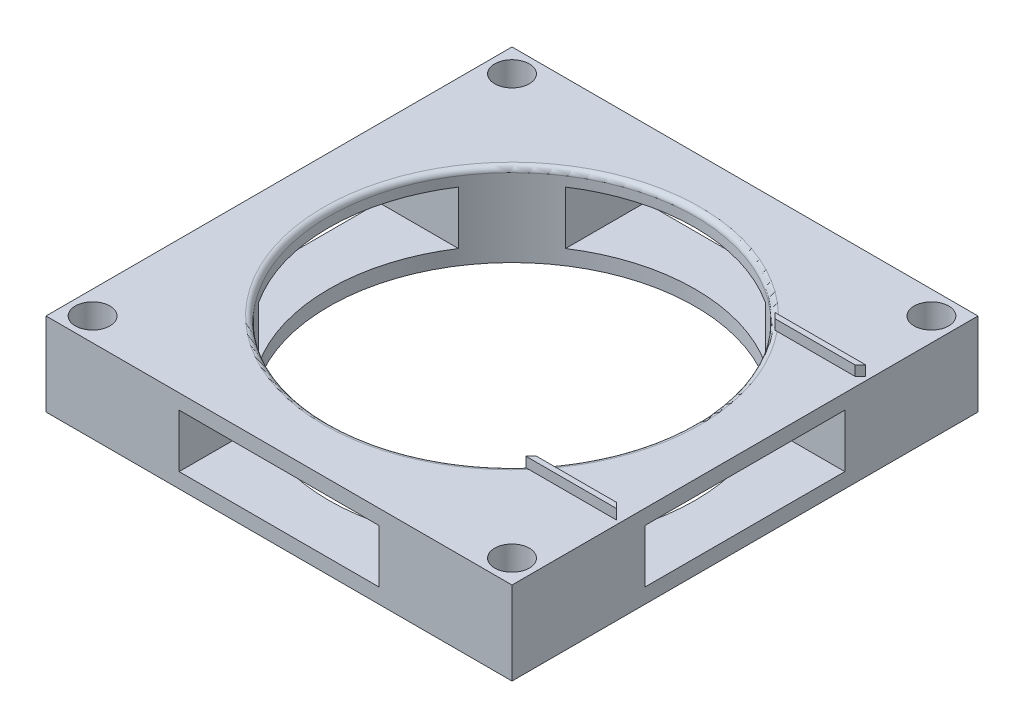
from build123d import *

# Parameters (mm, degrees)
SKETCH1_W           = 70
SKETCH1_H           = 70
SKETCH1_R           = 2.6
BOSS_EXTRUDE1_DEPTH = 12.5
SKETCH2_R           = 27.5
CUT_EXTRUDE1_DEPTH  = 14
FILLET1_R           = 0.8
BOSS_EXTRUDE2_DEPTH = 1.5
SKETCH5_W           = 30
SKETCH5_H           = 8
CUT_EXTRUDE2_DEPTH  = 80.504716841
SKETCH6_W           = 30
SKETCH6_H           = 8
CUT_EXTRUDE3_DEPTH  = 80.504716841


with BuildPart() as part:
    # Sketch1 → Boss-Extrude1 (new body)
    with BuildSketch(Plane(origin=(0, 0, 0), x_dir=(1, 0, 0), z_dir=(0, 1, 0))):
        Rectangle(SKETCH1_W, SKETCH1_H)
        with Locations(Location((31.5, 31.5, 0), (0, 0, 270))):
            Circle(SKETCH1_R, mode=Mode.SUBTRACT)
        with Locations(Location((-31.5, 31.5, 0), (0, 0, 270))):
            Circle(SKETCH1_R, mode=Mode.SUBTRACT)
        with Locations(Location((31.5, -31.5, 0), (0, 0, 270))):
            Circle(SKETCH1_R, mode=Mode.SUBTRACT)
        with Locations(Location((-31.5, -31.5, 0), (0, 0, 270))):
            Circle(SKETCH1_R, mode=Mode.SUBTRACT)
    extrude(amount=BOSS_EXTRUDE1_DEPTH)

    # Sketch2 → Cut-Extrude1 (cut)
    with BuildSketch(Plane(origin=(0, 12.5, 0), x_dir=(1, 0, 0), z_dir=(0, 1, 0))):
        with Locations(Location((0, 0, 0), (0, 0, 270))):
            Circle(SKETCH2_R)
    extrude(amount=-CUT_EXTRUDE1_DEPTH, mode=Mode.SUBTRACT)

    # Fillet1
    fillet1_edges = [part.edges().sort_by_distance(p)[0] for p in [
        (0, 12.5, -27.5),
    ]]
    fillet(fillet1_edges, radius=FILLET1_R)

    # Sketch3 → Boss-Extrude2 (add)
    with BuildSketch(Plane(origin=(0, 12.5, 0), x_dir=(1, 0, 0), z_dir=(0, 1, 0))):
        Polygon((33.6, 17.9), (21.6, 17.9), (20.8, 18.7), (34.4, 18.7), align=None)
        Polygon((33.6, -17.9), (21.6, -17.9), (20.8, -18.7), (34.4, -18.7), align=None)
    extrude(amount=BOSS_EXTRUDE2_DEPTH)

    # Sketch5 → Cut-Extrude2 (cut, through all)
    with BuildSketch(Plane.XY.offset(35)):
        with Locations((0, 6.25)):
            Rectangle(SKETCH5_W, SKETCH5_H)
    extrude(amount=-CUT_EXTRUDE2_DEPTH, mode=Mode.SUBTRACT)

    # Sketch6 → Cut-Extrude3 (cut, through all)
    with BuildSketch(Plane(origin=(35, 0, 0), x_dir=(0, 0, -1), z_dir=(1, 0, 0))):
        with Locations((0, 6.25)):
            Rectangle(SKETCH6_W, SKETCH6_H)
    extrude(amount=-CUT_EXTRUDE3_DEPTH, mode=Mode.SUBTRACT)


solid = part.part
